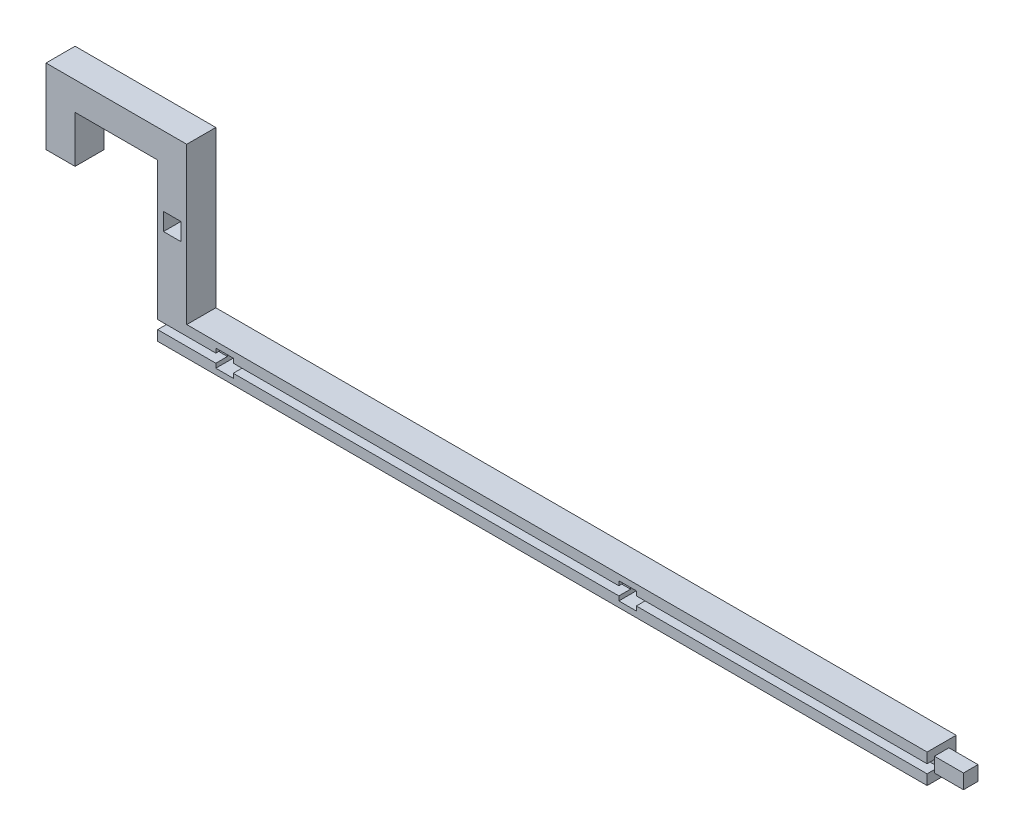
from build123d import *

# Parameters (mm, degrees)
BOSS_EXTRUDE1_DEPTH = 5
SKETCH2_W           = 2.5
SKETCH2_H           = 2.5
BOSS_EXTRUDE2_DEPTH = 5
SKETCH3_W           = 3
SKETCH3_H           = 3
CUT_EXTRUDE1_DEPTH  = 10
SKETCH4_W           = 132.3
SKETCH4_H           = 1.5
CUT_EXTRUDE2_DEPTH  = 2
SKETCH5_W           = 3
SKETCH5_H           = 3
CUT_EXTRUDE3_DEPTH  = 12


with BuildPart() as part:
    # Sketch1 → Boss-Extrude1 (new body)
    with BuildSketch(Plane.XY):
        Polygon((0, 6.7), (0, 8.05), (5.5, 8.05), (14.2, 8.05), (14.2, -18.95), (146.5, -18.95), (146.5, -13.95), (19.2, -13.95), (19.2, 12.9), (5.5, 12.9), (-5, 12.9), (-5, 0), (0, 0), align=None)
    extrude(amount=BOSS_EXTRUDE1_DEPTH)

    # Sketch2 → Boss-Extrude2 (add)
    with BuildSketch(Plane(origin=(146.5, 0, 0), x_dir=(0, 0, -1), z_dir=(1, 0, 0))):
        with Locations((-2.5, -16.45)):
            Rectangle(SKETCH2_W, SKETCH2_H)
    extrude(amount=BOSS_EXTRUDE2_DEPTH)

    # Sketch3 → Cut-Extrude1 (cut)
    with BuildSketch(Plane.XY.offset(5)):
        with Locations((16.7, -0.6)):
            Rectangle(SKETCH3_W, SKETCH3_H)
    extrude(amount=-CUT_EXTRUDE1_DEPTH, mode=Mode.SUBTRACT)

    # Sketch4 → Cut-Extrude2 (cut)
    with BuildSketch(Plane.XY.offset(5)):
        with Locations((80.35, -16.45)):
            Rectangle(SKETCH4_W, SKETCH4_H)
    extrude(amount=-CUT_EXTRUDE2_DEPTH, mode=Mode.SUBTRACT)

    # Sketch5 → Cut-Extrude3 (cut)
    with BuildSketch(Plane(origin=(0, 0, 0), x_dir=(-1, 0, 0), z_dir=(0, 0, -1))):
        with Locations((-25.7, -16.45)):
            Rectangle(SKETCH5_W, SKETCH5_H)
        with Locations((-95, -16.45)):
            Rectangle(SKETCH5_W, SKETCH5_H)
    extrude(amount=-CUT_EXTRUDE3_DEPTH, mode=Mode.SUBTRACT)


solid = part.part
